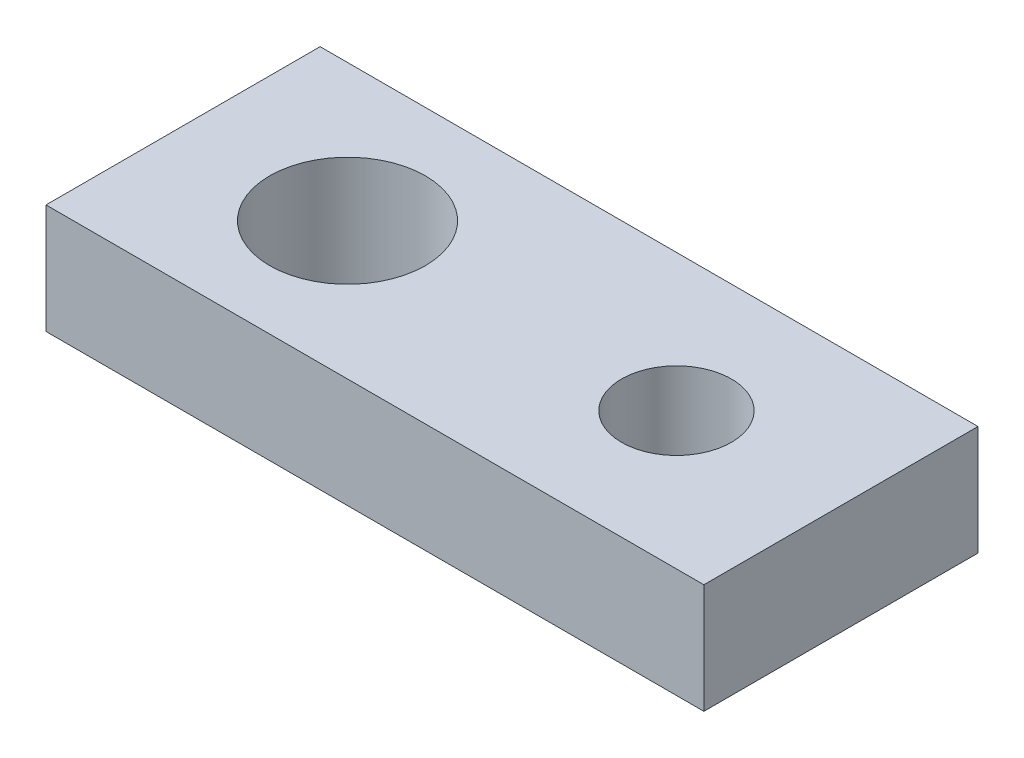
from build123d import *

# Parameters (mm, degrees)
SKETCH1_W           = 76.2
SKETCH1_H           = 31.75
BOSS_EXTRUDE1_DEPTH = 12.7
SKETCH2_R           = 9.017
SKETCH2_R_2         = 6.3627
CUT_EXTRUDE1_DEPTH  = 44.184668865


with BuildPart() as part:
    # Sketch1 → Boss-Extrude1 (new body)
    with BuildSketch(Plane(origin=(0, 0, 0), x_dir=(1, 0, 0), z_dir=(0, 1, 0))):
        Rectangle(SKETCH1_W, SKETCH1_H)
    extrude(amount=BOSS_EXTRUDE1_DEPTH)

    # Sketch2 → Cut-Extrude1 (cut, through all)
    with BuildSketch(Plane(origin=(0, 12.7, 0), x_dir=(1, 0, 0), z_dir=(0, 1, 0))):
        with Locations(Location((-19.05, 0, 0), (0, 0, 270))):
            Circle(SKETCH2_R)
        with Locations(Location((19.05, 0, 0), (0, 0, 270))):
            Circle(SKETCH2_R_2)
    extrude(amount=-CUT_EXTRUDE1_DEPTH, mode=Mode.SUBTRACT)


solid = part.part
